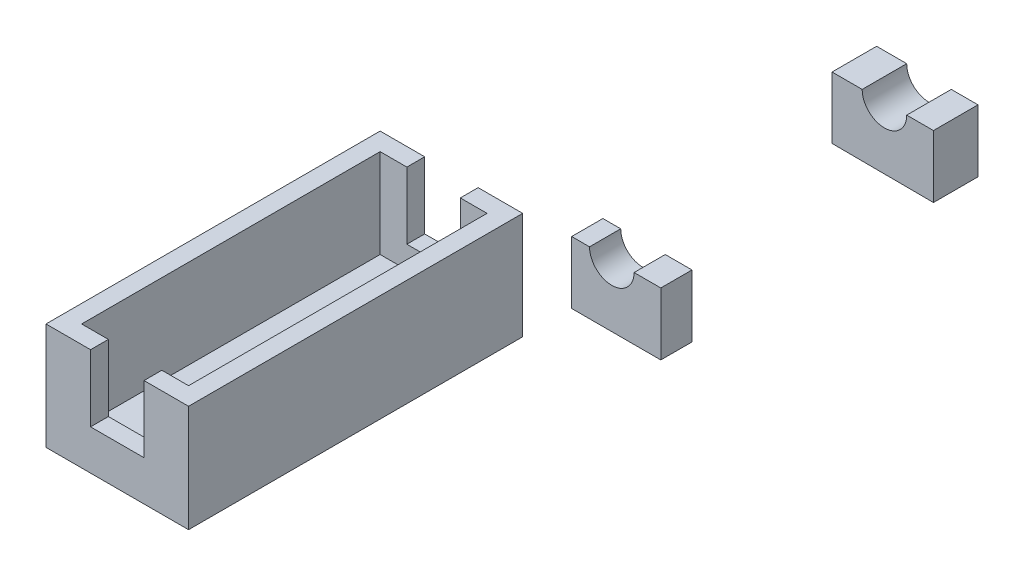
from build123d import *

# Parameters (mm, degrees)
BOSS_EXTRUDE1_DEPTH = 33.5
BOSS_EXTRUDE2_DEPTH = 2
BOSS_EXTRUDE3_START = 33.5
BOSS_EXTRUDE3_DEPTH = 2
BOSS_EXTRUDE4_START = 5.5
BOSS_EXTRUDE4_DEPTH = 3.5
BOSS_EXTRUDE5_DEPTH = 5


with BuildPart() as part:
    # Sketch1 → Boss-Extrude1 (new body)
    with BuildSketch(Plane.XY):
        Polygon((-6, 5), (-6, -5), (6, -5), (6, 5), (8, 5), (8, -7), (-8, -7), (-8, 5), align=None)
    extrude(amount=BOSS_EXTRUDE1_DEPTH)

    # Sketch1<3> → Boss-Extrude2 (add)
    with BuildSketch(Plane.XY):
        Polygon((-3, -2.5), (-3, 5), (-6, 5), (-6, -5), (6, -5), (6, 5), (3, 5), (3, -2.5), (0, -2.5), align=None)
        Polygon((-6, 5), (-6, -5), (6, -5), (6, 5), (8, 5), (8, -7), (-8, -7), (-8, 5), align=None)
    extrude(amount=-BOSS_EXTRUDE2_DEPTH)

    # Sketch1<4> → Boss-Extrude3 (add)
    with BuildSketch(Plane.XY.offset(BOSS_EXTRUDE3_START)):
        Polygon((-3, -2.5), (-3, 5), (-6, 5), (-6, -5), (6, -5), (6, 5), (3, 5), (3, -2.5), (0, -2.5), align=None)
        Polygon((-6, 5), (-6, -5), (6, -5), (6, 5), (8, 5), (8, -7), (-8, -7), (-8, 5), align=None)
    extrude(amount=BOSS_EXTRUDE3_DEPTH)


with BuildPart() as body_2:
    # Sketch3 → Boss-Extrude4 (new body)
    with BuildSketch(Plane(origin=(0, 0, -2), x_dir=(-1, 0, 0), z_dir=(0, 0, -1)).offset(BOSS_EXTRUDE4_START)):
        with BuildLine():
            ThreePointArc((-10, 0), (-12.5, -2.5), (-15, 0))
            Line((-15, 0), (-18, 0))
            Line((-18, 0), (-18, -7))
            Line((-18, -7), (-8, -7))
            Line((-8, -7), (-8, 0))
            Line((-8, 0), (-10, 0))
        make_face()
    extrude(amount=BOSS_EXTRUDE4_DEPTH)


with BuildPart() as body_3:
    # Sketch4 → Boss-Extrude5 (new body)
    with BuildSketch(Plane(origin=(0, 0, -38.1), x_dir=(-1, 0, 0), z_dir=(0, 0, -1))):
        with BuildLine():
            Line((-6.620772797, 0), (-10, 0))
            ThreePointArc((-10, 0), (-12.5, -2.5), (-15, 0))
            Line((-15, 0), (-18, 0))
            Line((-18, 0), (-18, -7))
            Line((-18, -7), (-6.620772797, -6.945839582))
            Line((-6.620772797, -6.945839582), (-6.620772797, 0))
        make_face()
    extrude(amount=BOSS_EXTRUDE5_DEPTH)


solid = Compound([part.part, body_2.part, body_3.part])
